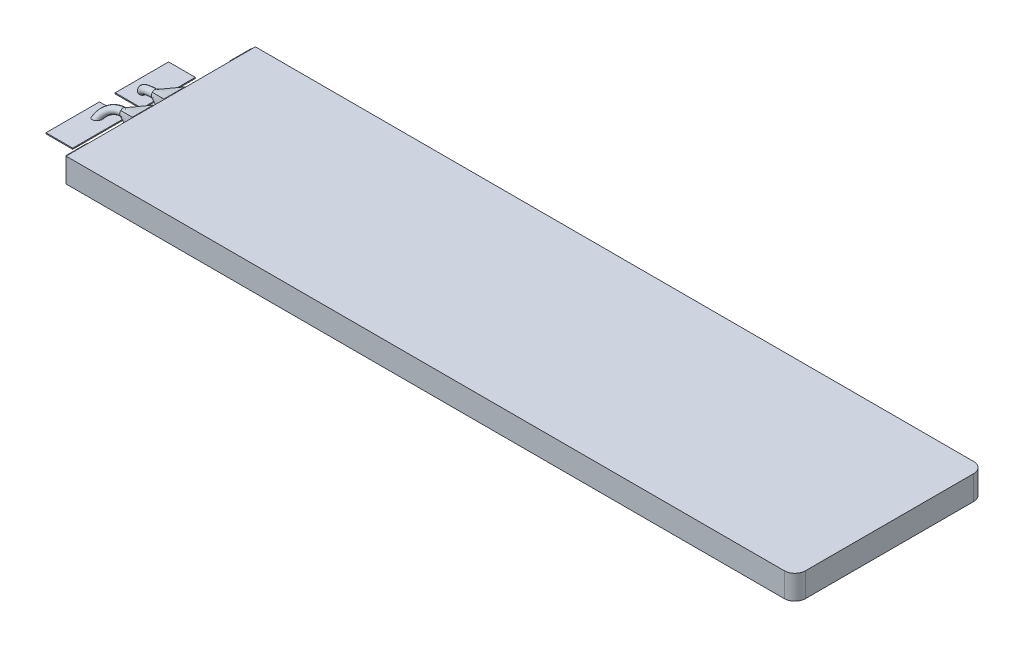
from build123d import *

# Parameters (mm, degrees)
BOSS_EXTRUDE1_DEPTH = 2.3
SKETCH2_W           = 2
SKETCH2_H           = 2
BOSS_EXTRUDE2_DEPTH = 0.2
SKETCH4_R           = 0.34
SKETCH7_W           = 2.54
SKETCH7_H           = 5.08
BOSS_EXTRUDE3_DEPTH = 0.1


with BuildPart() as part:
    # Sketch1 → Boss-Extrude1 (new body)
    with BuildSketch(Plane(origin=(0, 0, 0), x_dir=(1, 0, 0), z_dir=(0, 1, 0))):
        with BuildLine():
            Line((-34.65, 9), (33.65, 9))
            ThreePointArc((33.65, 9), (34.357106781, 8.707106781), (34.65, 8))
            Line((34.65, 8), (34.65, -8))
            ThreePointArc((34.65, -8), (34.357106781, -8.707106781), (33.65, -9))
            Line((33.65, -9), (-34.65, -9))
            Line((-34.65, -9), (-34.65, 9))
        make_face()
    extrude(amount=BOSS_EXTRUDE1_DEPTH)

    # Sketch2 → Boss-Extrude2 (add)
    with BuildSketch(Plane.ZY.offset(34.65)):
        with Locations((-7.8, 1.15)):
            Rectangle(SKETCH2_W, SKETCH2_H)
        with Locations((-1.5, 1.15)):
            Rectangle(SKETCH2_W, SKETCH2_H)
        with Locations((1.5, 1.15)):
            Rectangle(SKETCH2_W, SKETCH2_H)
        with Locations((7.8, 1.15)):
            Rectangle(SKETCH2_W, SKETCH2_H)
    extrude(amount=BOSS_EXTRUDE2_DEPTH)

    # Sketch6 → Loft1 section 0
    with BuildSketch(Plane.ZY.offset(34.85)):
        with BuildLine():
            Line((-2.5, 2.15), (-0.5, 2.15))
            Line((-0.5, 2.15), (-0.5, 0.15))
            Line((-0.5, 0.15), (-2.5, 0.15))
            Line((-2.5, 0.15), (-2.5, 2.15))
        make_face()
    # Sketch5 for Loft1 → Loft1 section 1
    with BuildSketch(Plane(origin=(-36.709589787, 1.15, -1.5), x_dir=(0, 0, 1), z_dir=(-1, 0, 0))):
        with BuildLine():
            # circular arc as an exact rational Bezier (weights 1, cos(half-angle), 1)
            Bezier((-0.240416306, 0.240416306), (0, 0.48083261), (0.240416306, 0.240416306), weights=[1, 0.707106784, 1])
            Bezier((0.240416306, 0.240416306), (0.48083261, 0), (0.240416306, -0.240416306), weights=[1, 0.707106784, 1])
            Bezier((0.240416306, -0.240416306), (0, -0.48083261), (-0.240416306, -0.240416306), weights=[1, 0.707106784, 1])
            Bezier((-0.240416306, -0.240416306), (-0.48083261, 0), (-0.240416306, 0.240416306), weights=[1, 0.707106784, 1])
        make_face()
    loft1 = loft()

    # Sweep2: sweep along a curve in space
    with BuildLine() as sweep2_path:
        Line((-34.85, 1.15, -1.5), (-36.709589787, 1.15, -1.5))
        ThreePointArc((-36.709589787, 1.15, -1.5), (-38.088738075, 0.666726189, -1.804608948), (-38.66, -0.5, -2.54))
    # Sketch4 → Sweep2 (sweep)
    with BuildSketch(Plane.ZY.offset(34.85)):
        with Locations((-1.5, 1.15)):
            Circle(SKETCH4_R)
    sweep2 = sweep(path=sweep2_path.line)

    # Mirror4: Loft1, Sweep2 across plane
    add(loft1.mirror(Plane.XY))
    add(sweep2.mirror(Plane.XY))

    # Sketch7 → Boss-Extrude3 (add)
    with BuildSketch(Plane(origin=(0, 0, 0), x_dir=(1, 0, 0), z_dir=(0, 1, 0))):
        with Locations((-38.46, 3.29)):
            Rectangle(SKETCH7_W, SKETCH7_H)
        with Locations((-38.46, -3.29)):
            Rectangle(SKETCH7_W, SKETCH7_H)
    extrude(amount=BOSS_EXTRUDE3_DEPTH)


solid = part.part
